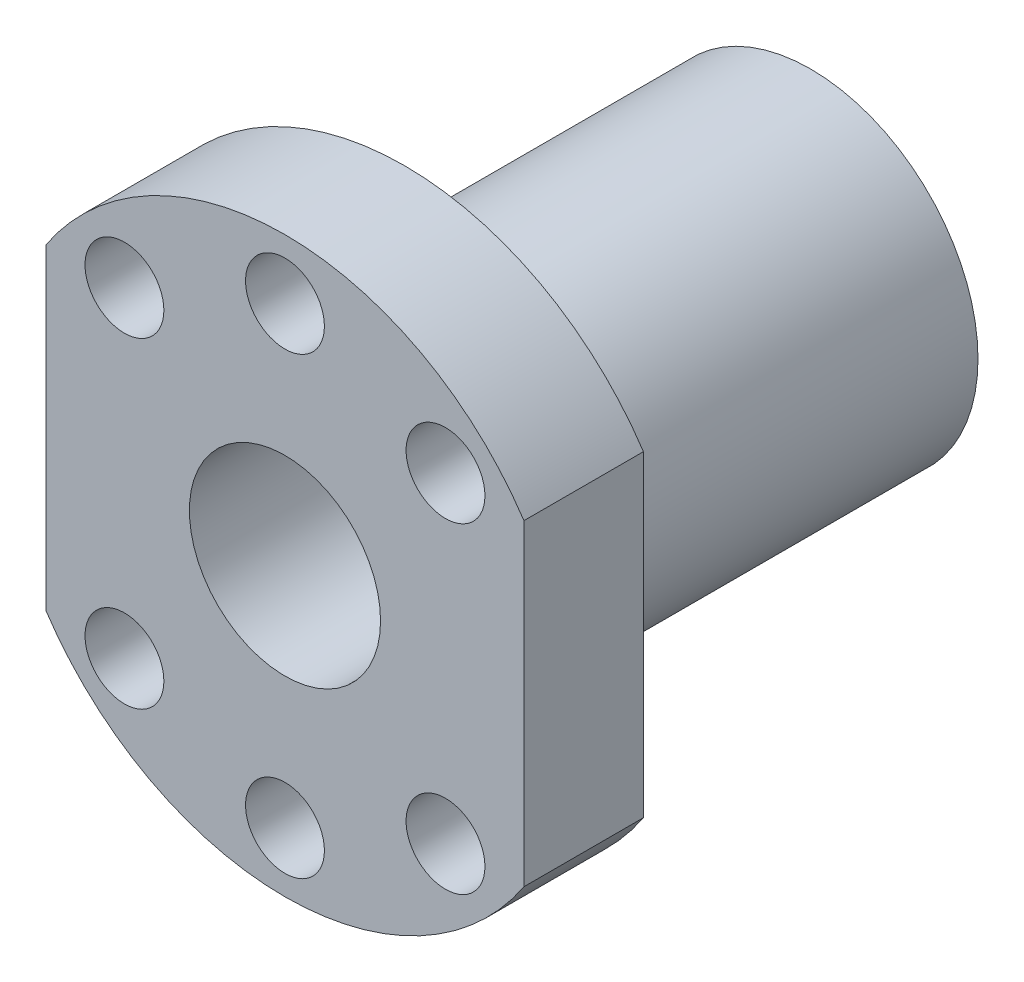
from build123d import *

# Parameters (mm, degrees)
SZKIC2_R                   = 3.3
SZKIC2_R_2                 = 8
WYTNIJ_WYCI_GNI_CIE1_DEPTH = 56.569775958


with BuildPart() as part:
    # Szkic1 → Obrót1 (revolve)
    with BuildSketch(Plane(origin=(0, 0, 0), x_dir=(0, 0, -1), z_dir=(1, 0, 0)), mode=Mode.PRIVATE) as obr_t1_sk:
        Polygon((0, 0), (44, 0), (44, 14), (10, 14), (10, 24), (0, 24), align=None)
    revolve(obr_t1_sk.sketch.rotate(Axis((0, 0, 0), (0, 0, -1)), 90), axis=Axis((0, 0, 0), (0, 0, -1)))

    # Szkic2 → Wytnij-wyciągnięcie1 (cut, through all)
    with BuildSketch(Plane.XY):
        with Locations((-13.435028843, 13.435028843)):
            Circle(SZKIC2_R)
        with Locations((0, 19)):
            Circle(SZKIC2_R)
        with Locations((13.435028843, 13.435028843)):
            Circle(SZKIC2_R)
        Circle(SZKIC2_R_2)
        with BuildLine():
            Line((-20, 13.266499161), (-20, -13.266499161))
            ThreePointArc((-20, -13.266499161), (-24, 0), (-20, 13.266499161))
        make_face()
        with BuildLine():
            Line((20, -13.266499161), (20, 13.266499161))
            ThreePointArc((20, 13.266499161), (24, 0), (20, -13.266499161))
        make_face()
    wytnij_wyci_gni_cie1 = extrude(amount=-WYTNIJ_WYCI_GNI_CIE1_DEPTH, mode=Mode.SUBTRACT)

    # Lustro1: Wytnij-wyciągnięcie1 across plane
    add(wytnij_wyci_gni_cie1.mirror(Plane.ZX), mode=Mode.SUBTRACT)


solid = part.part
